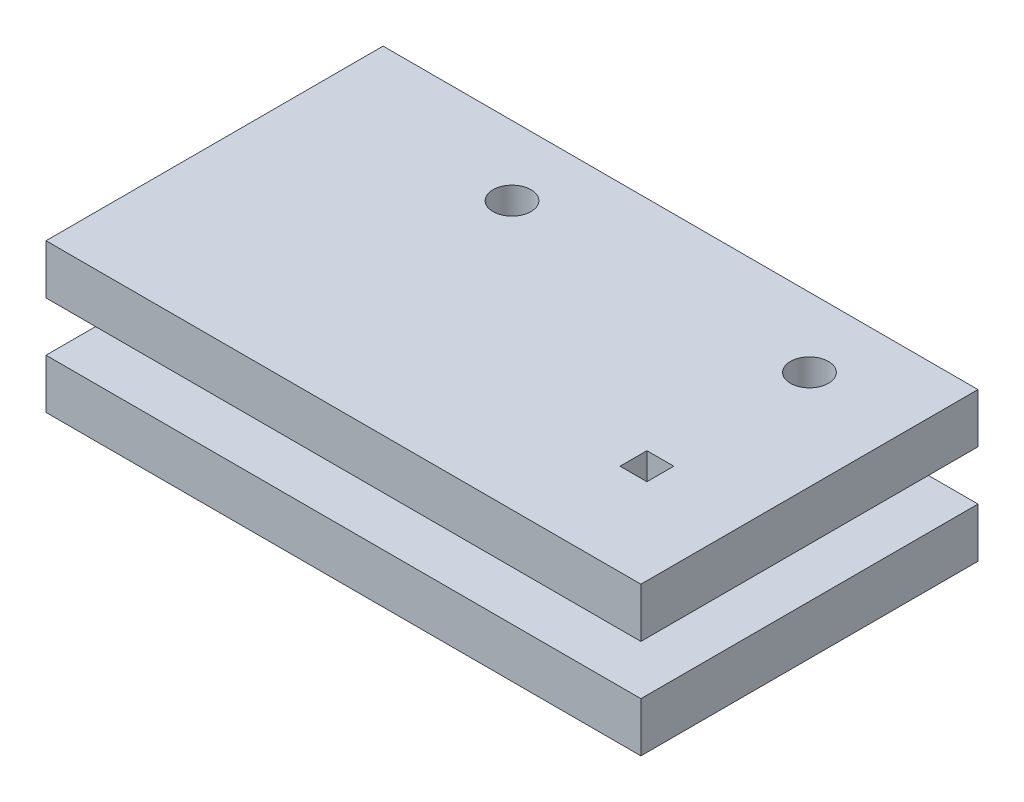
from build123d import *

# Parameters (mm, degrees)
SKETCH1_W               = 76.2
SKETCH1_H               = 19.05
BOSS_EXTRUDE1_DEPTH     = 43.18
SKETCH2_W               = 76.2
SKETCH2_H               = 6.35
CUT_EXTRUDE1_DEPTH      = 59.36821074
CUT_EXTRUDE2_DEPTH      = 61.654965996
CUT_EXTRUDE2_DEPTH_BACK = 61.654965996
SKETCH3_R               = 2.434895054
SKETCH3_W               = 3.44346125
SKETCH3_H               = 3.443461249


with BuildPart() as part:
    # Sketch1 → Boss-Extrude1 (new body)
    with BuildSketch(Plane.XY):
        Rectangle(SKETCH1_W, SKETCH1_H)
    extrude(amount=BOSS_EXTRUDE1_DEPTH)

    # Sketch2 → Cut-Extrude1 (cut, through all)
    with BuildSketch(Plane(origin=(0, 0, 0), x_dir=(-1, 0, 0), z_dir=(0, 0, -1))):
        Rectangle(SKETCH2_W, SKETCH2_H)
    extrude(amount=-CUT_EXTRUDE1_DEPTH, mode=Mode.SUBTRACT)


with BuildPart() as cut_extrude1_piece_1:
    # of the separate pieces the step leaves, piece 1, a body of its own (cut_extrude1_pieces)
    add(part.part.solids().sort_by_distance((-38.1, 9.525, 0))[0])


with BuildPart() as cut_extrude1_piece_2:
    # of the separate pieces the step leaves, piece 2, a body of its own (cut_extrude1_pieces)
    add(part.part.solids().sort_by_distance((-38.1, -9.525, 0))[0])


with BuildPart() as cut_extrude2_tool:
    # Sketch3 → Cut-Extrude2 (new, two sides: drawn at the far end of the back side and taken through both)
    with BuildSketch(Plane.XZ.offset(9.525).offset(-CUT_EXTRUDE2_DEPTH_BACK)):
        with Locations(Location((25.4, 8.89, 0), (0, 0, 270))):
            Circle(SKETCH3_R)
        with Locations(Location((-12.7, 8.89, 0), (0, 0, 270))):
            Circle(SKETCH3_R)
        with Locations((25.4, 29.707720771)):
            Rectangle(SKETCH3_W, SKETCH3_H)
    extrude(amount=CUT_EXTRUDE2_DEPTH + CUT_EXTRUDE2_DEPTH_BACK)


with BuildPart() as cut_extrude1_piece_1_1:
    add(cut_extrude1_piece_1.part)

    # Cut-Extrude2: cut by cut_extrude2_tool
    add(cut_extrude2_tool.part, mode=Mode.SUBTRACT)


with BuildPart() as cut_extrude1_piece_2_1:
    add(cut_extrude1_piece_2.part)

    # Cut-Extrude2: cut by cut_extrude2_tool
    add(cut_extrude2_tool.part, mode=Mode.SUBTRACT)


solid = Compound([cut_extrude1_piece_1_1.part, cut_extrude1_piece_2_1.part])
